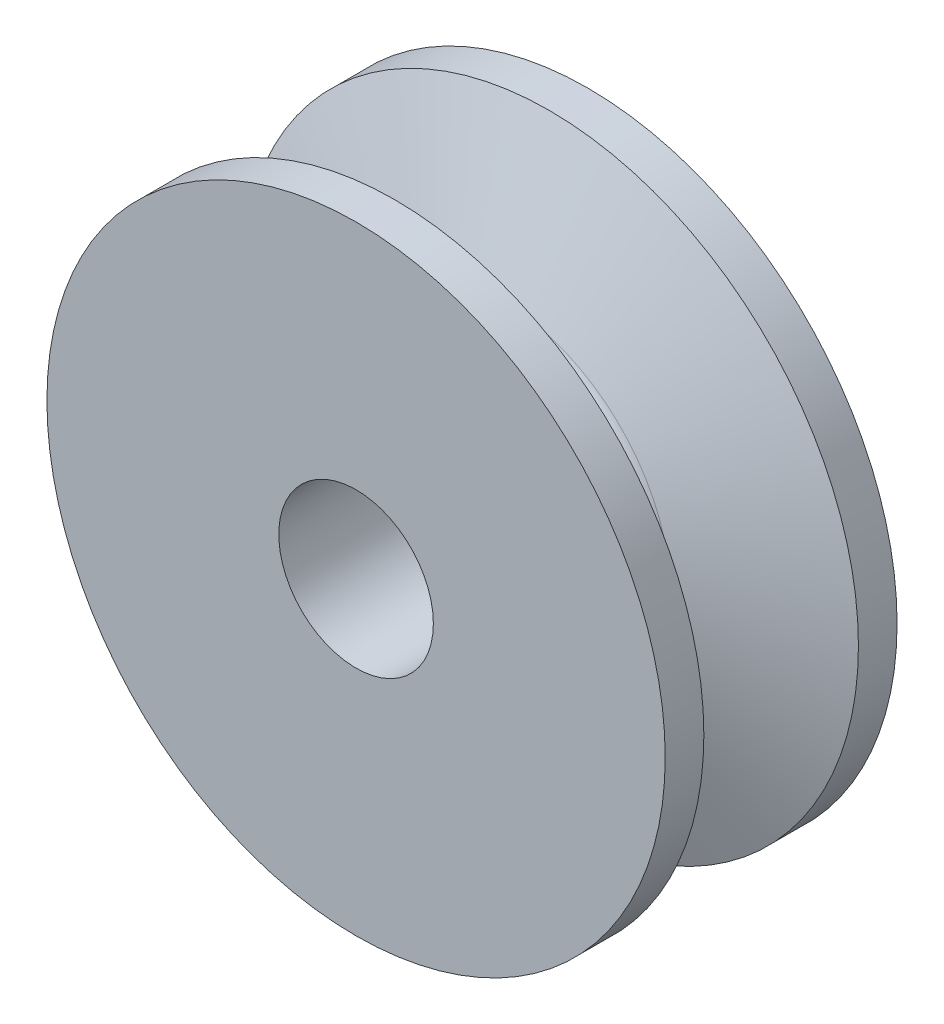
from build123d import *

# Parameters (mm, degrees)
ESQUISSE1_R             = 20
BOSS_EXTRU_1_DEPTH      = 7.5
CONG_1_R                = 1.7
CONG_3_R                = 1.7
ESQUISSE5_R             = 5
ENL_V_MAT_EXTRU_1_DEPTH = 33.015621312


with BuildPart() as part:
    # Esquisse1 → Boss.-Extru.1 (new, symmetric)
    with BuildSketch(Plane.XY):
        Circle(ESQUISSE1_R)
    extrude(amount=BOSS_EXTRU_1_DEPTH, both=True)

    # Esquisse4 → Enlèvement de matière-Révolution1 (revolve, cut)
    with BuildSketch(Plane(origin=(0, 0, 0), x_dir=(0, 0, -1), z_dir=(1, 0, 0)), mode=Mode.PRIVATE) as enl_vement_de_mati_re_r_volution1_sk:
        Polygon((-5, 20), (-1.324936438, 10), (1.324936438, 10), (5, 20), align=None)
    revolve(enl_vement_de_mati_re_r_volution1_sk.sketch.rotate(Axis((0, 0, 15.788572615), (0, 0, -1)), 90), axis=Axis((0, 0, 15.788572615), (0, 0, -1)), mode=Mode.SUBTRACT)

    # Congé1
    cong_1_edges = [part.edges().sort_by_distance(p)[0] for p in [
        (-10, 0, -1.324936438),
    ]]
    fillet(cong_1_edges, radius=CONG_1_R)

    # Congé3
    cong_3_edges = [part.edges().sort_by_distance(p)[0] for p in [
        (-10, 0, 1.324936438),
    ]]
    fillet(cong_3_edges, radius=CONG_3_R)

    # Esquisse5 → Enlèv. mat.-Extru.1 (cut, through all)
    with BuildSketch(Plane.XY.offset(7.5)):
        Circle(ESQUISSE5_R)
    extrude(amount=-ENL_V_MAT_EXTRU_1_DEPTH, mode=Mode.SUBTRACT)


solid = part.part
